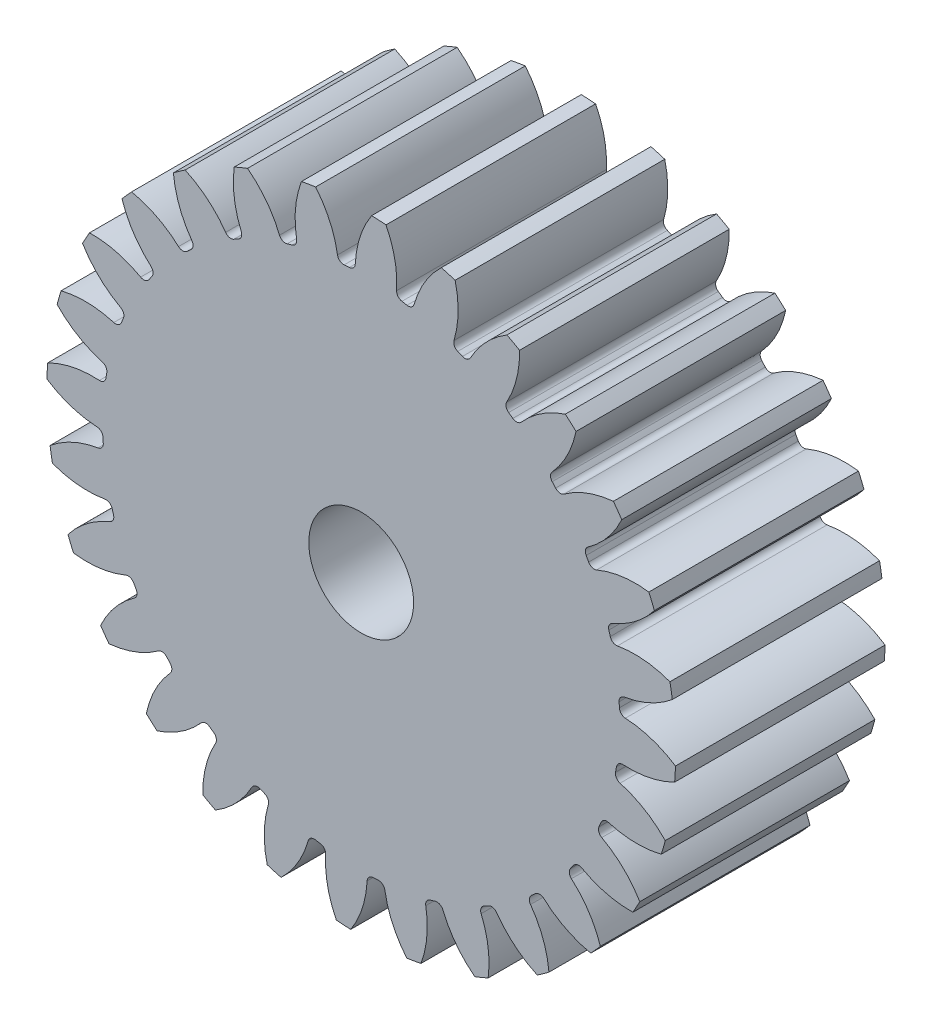
from build123d import *

# Parameters (mm, degrees)
SALIENTE_EXTRUIR1_DEPTH = 10
REDONDEO1_R             = 0.3
MATRIZC1_COUNT          = 28
REDONDEO1_OF_MATRIZC1_R = 0.3
CROQUIS3_R              = 2.5
CORTAR_EXTRUIR1_DEPTH   = 24.441510139


with BuildPart() as part:
    # Croquis2 → Saliente-Extruir1 (new body)
    with BuildSketch(Plane.XY):
        with BuildLine():
            ThreePointArc((-0.288654869, 12.32662072), (-0.691360714, -12.31060195), (1.667007514, 12.216791148))
            ThreePointArc((1.667007514, 12.216791148), (1.628313014, 13.620812844), (1.183901136, 14.953206282))
            ThreePointArc((1.183901136, 14.953206282), (0.841071429, 14.976401399), (0.497800364, 14.991737551))
            ThreePointArc((0.497800364, 14.991737551), (-0.093000384, 13.717481428), (-0.288654869, 12.32662072))
        make_face()
    saliente_extruir1 = extrude(amount=SALIENTE_EXTRUIR1_DEPTH)

    # Redondeo1
    redondeo1_edges = [part.edges().sort_by_distance(p)[0] for p in [
        (-0.288654869, 12.32662072, 5),
        (1.667007514, 12.216791148, 5),
    ]]
    fillet(redondeo1_edges, radius=REDONDEO1_R)

    # MatrizC1: Saliente-Extruir1 ×28 about axis
    matrizc1_axis = Axis((0, 0, 10), (0, 0, 1))
    for i in range(1, MATRIZC1_COUNT):
        add(saliente_extruir1.rotate(matrizc1_axis, i * 360 / MATRIZC1_COUNT))

    # Redondeo1 of MatrizC1
    redondeo1_of_matrizc1_edges = [part.edges().sort_by_distance(p)[0] for p in [
        (-3.024348844, 11.953334851, 5),
        (-1.093279621, 12.281434756, 5),
        (-5.608389339, 10.980658861, 5),
        (-3.79874515, 11.730235943, 5),
        (-7.911201774, 9.457366784, 5),
        (-6.313725736, 10.590834119, 5),
        (-9.817313518, 7.459842846, 5),
        (-8.512109749, 8.920363648, 5),
        (-11.231144169, 5.088251238, 5),
        (-10.283661036, 6.802588896, 5),
        (-12.081798354, 2.461513466, 5),
        (-11.539546618, 4.343703932, 5),
        (-12.32662072, -0.288654869, 5),
        (-12.216791148, 1.667007514, 5),
        (-11.953334851, -3.024348844, 5),
        (-12.281434756, -1.093279621, 5),
        (-10.980658861, -5.608389339, 5),
        (-11.730235943, -3.79874515, 5),
        (-9.457366784, -7.911201774, 5),
        (-10.590834119, -6.313725736, 5),
        (-7.459842846, -9.817313518, 5),
        (-8.920363648, -8.512109749, 5),
        (-5.088251238, -11.231144169, 5),
        (-6.802588896, -10.283661036, 5),
        (-2.461513466, -12.081798354, 5),
        (-4.343703932, -11.539546618, 5),
        (0.288654869, -12.32662072, 5),
        (-1.667007514, -12.216791148, 5),
        (3.024348844, -11.953334851, 5),
        (1.093279621, -12.281434756, 5),
        (5.608389339, -10.980658861, 5),
        (3.79874515, -11.730235943, 5),
        (7.911201774, -9.457366784, 5),
        (6.313725736, -10.590834119, 5),
        (9.817313518, -7.459842846, 5),
        (8.512109749, -8.920363648, 5),
        (11.231144169, -5.088251238, 5),
        (10.283661036, -6.802588896, 5),
        (12.081798354, -2.461513466, 5),
        (11.539546618, -4.343703932, 5),
        (12.32662072, 0.288654869, 5),
        (12.216791148, -1.667007514, 5),
        (11.953334851, 3.024348844, 5),
        (12.281434756, 1.093279621, 5),
        (10.980658861, 5.608389339, 5),
        (11.730235943, 3.79874515, 5),
        (9.457366784, 7.911201774, 5),
        (10.590834119, 6.313725736, 5),
        (7.459842846, 9.817313518, 5),
        (8.920363648, 8.512109749, 5),
        (5.088251238, 11.231144169, 5),
        (6.802588896, 10.283661036, 5),
        (2.461513466, 12.081798354, 5),
        (4.343703932, 11.539546618, 5),
    ]]
    fillet(redondeo1_of_matrizc1_edges, radius=REDONDEO1_OF_MATRIZC1_R)

    # Croquis3 → Cortar-Extruir1 (cut, through all)
    with BuildSketch(Plane.XY.offset(10)):
        Circle(CROQUIS3_R)
    extrude(amount=-CORTAR_EXTRUIR1_DEPTH, mode=Mode.SUBTRACT)


solid = part.part
